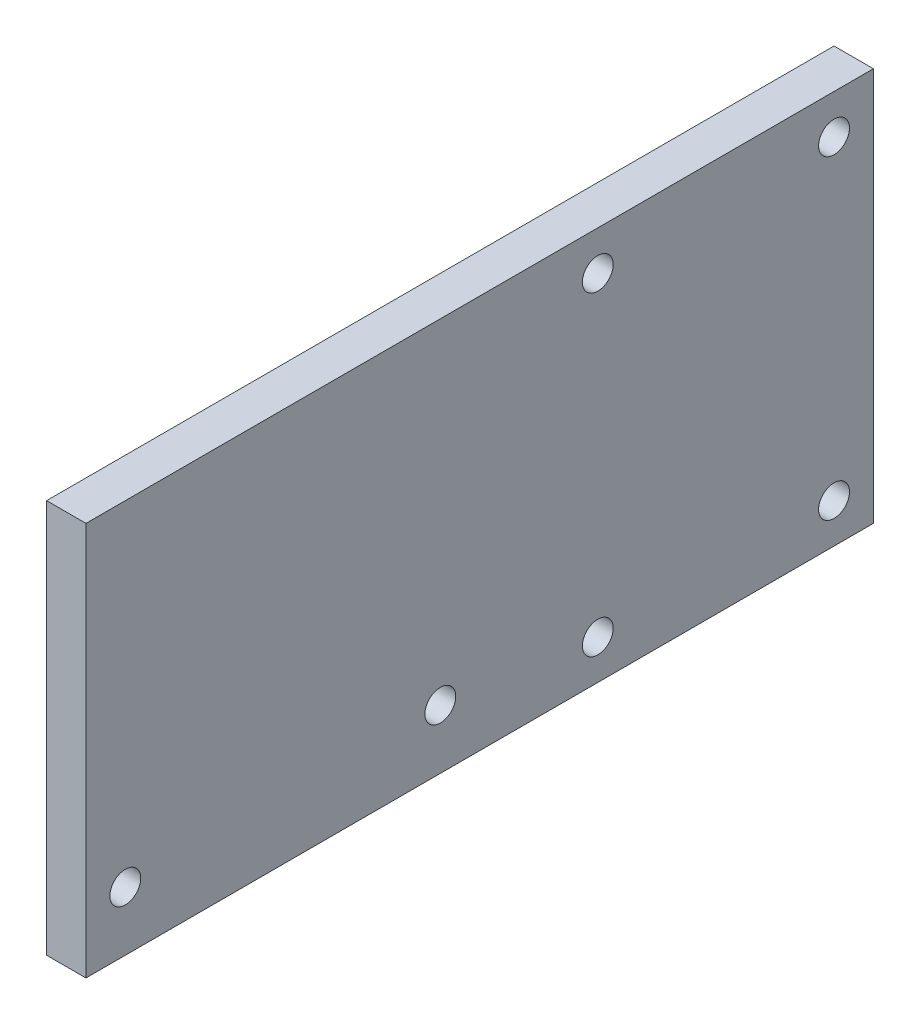
from build123d import *

# Parameters (mm, degrees)
SKETCH1_W                      = 127
SKETCH1_H                      = 63.5
BOSS_EXTRUDE1_DEPTH            = 6.35
F_9_0_196_DIAMETER_HOLE1_D     = 4.9784
F_9_0_196_DIAMETER_HOLE1_DEPTH = 70.104
F_9_0_196_DIAMETER_HOLE1_TIP   = 1.495662253
F_9_0_196_DIAMETER_HOLE2_D     = 4.9784
F_9_0_196_DIAMETER_HOLE2_DEPTH = 70.104
F_9_0_196_DIAMETER_HOLE2_TIP   = 1.495662253


with BuildPart() as part:
    # Sketch1 → Boss-Extrude1 (new body)
    with BuildSketch(Plane(origin=(0, 0, 0), x_dir=(0, 0, -1), z_dir=(1, 0, 0))):
        Rectangle(SKETCH1_W, SKETCH1_H)
    extrude(amount=BOSS_EXTRUDE1_DEPTH)

    # #9 (0.196) Diameter Hole1
    with Locations(Plane.ZY):
        with Locations((57.15, -22.225), (6.35, -22.225)):
            Hole(F_9_0_196_DIAMETER_HOLE1_D / 2, depth=F_9_0_196_DIAMETER_HOLE1_DEPTH)
            with Locations((0, 0, -(F_9_0_196_DIAMETER_HOLE1_DEPTH + F_9_0_196_DIAMETER_HOLE1_TIP / 2))):  # 118° drill point
                Cone(0, F_9_0_196_DIAMETER_HOLE1_D / 2, F_9_0_196_DIAMETER_HOLE1_TIP, mode=Mode.SUBTRACT)

    # #9 (0.196) Diameter Hole2
    with Locations(Plane.ZY):
        with Locations((-57.15, -25.4), (-19.05, -25.4), (-19.05, 25.4), (-57.15, 25.4)):
            Hole(F_9_0_196_DIAMETER_HOLE2_D / 2, depth=F_9_0_196_DIAMETER_HOLE2_DEPTH)
            with Locations((0, 0, -(F_9_0_196_DIAMETER_HOLE2_DEPTH + F_9_0_196_DIAMETER_HOLE2_TIP / 2))):  # 118° drill point
                Cone(0, F_9_0_196_DIAMETER_HOLE2_D / 2, F_9_0_196_DIAMETER_HOLE2_TIP, mode=Mode.SUBTRACT)


solid = part.part
